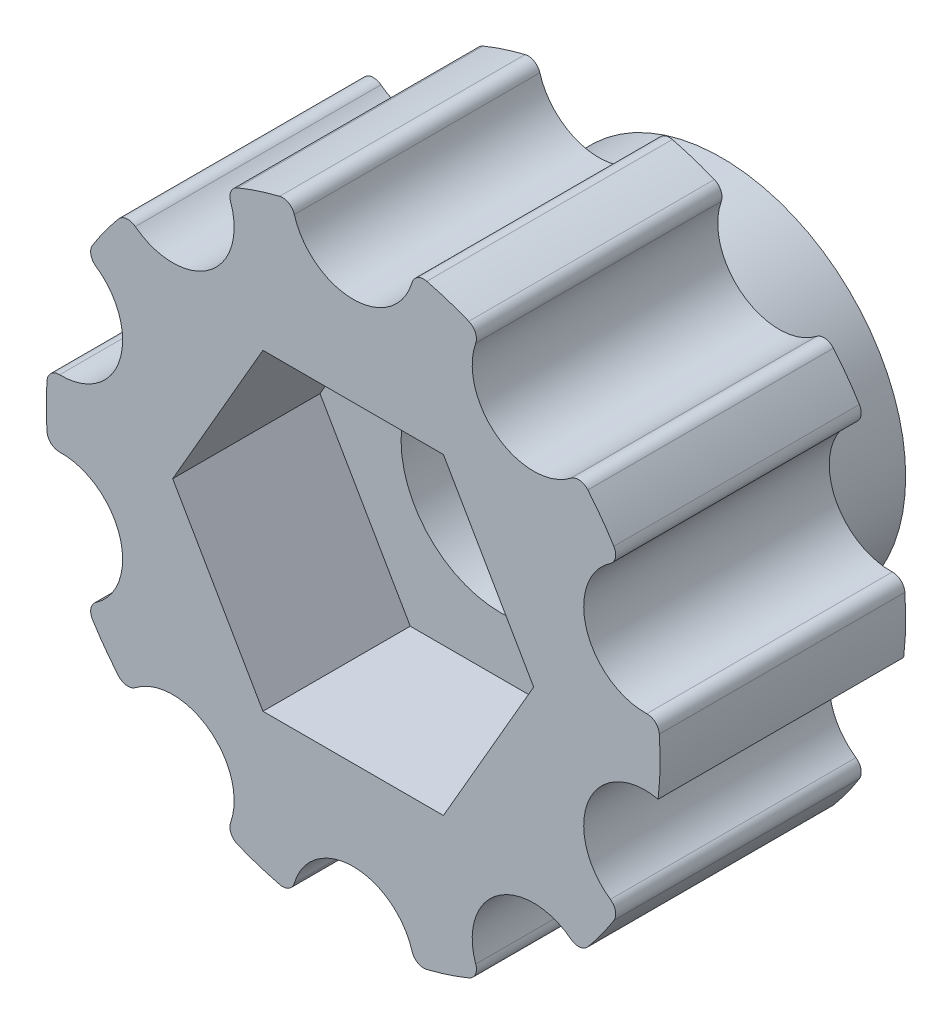
from build123d import *

# Parameters (mm, degrees)
SKETCH1_R           = 12.5
BOSS_EXTRUDE1_DEPTH = 10
SKETCH2_R           = 7.5
BOSS_EXTRUDE2_DEPTH = 5
SKETCH3_R           = 4.05
CUT_EXTRUDE1_DEPTH  = 24.184046239
CUT_EXTRUDE2_DEPTH  = 6
SKETCH5_R           = 2.5
CUT_EXTRUDE3_DEPTH  = 24.184046239
FILLET1_R           = 0.5


with BuildPart() as part:
    # Sketch1 → Boss-Extrude1 (new body)
    with BuildSketch(Plane.XY):
        Circle(SKETCH1_R)
    extrude(amount=BOSS_EXTRUDE1_DEPTH)

    # Sketch2 → Boss-Extrude2 (add)
    with BuildSketch(Plane(origin=(0, 0, 0), x_dir=(-1, 0, 0), z_dir=(0, 0, -1))):
        Circle(SKETCH2_R)
    extrude(amount=BOSS_EXTRUDE2_DEPTH)

    # Sketch3 → Cut-Extrude1 (cut, through all)
    with BuildSketch(Plane(origin=(0, 0, -5), x_dir=(-1, 0, 0), z_dir=(0, 0, -1))):
        Circle(SKETCH3_R)
    extrude(amount=-CUT_EXTRUDE1_DEPTH, mode=Mode.SUBTRACT)

    # Sketch4 → Cut-Extrude2 (cut)
    with BuildSketch(Plane.XY.offset(10)):
        Polygon((3.675, 6.365286718), (-3.675, 6.365286718), (-7.35, 0), (-3.675, -6.365286718), (3.675, -6.365286718), (7.35, 0), align=None)
    extrude(amount=-CUT_EXTRUDE2_DEPTH, mode=Mode.SUBTRACT)

    # Sketch5 → Cut-Extrude3 (cut, through all)
    with BuildSketch(Plane.XY.offset(10)):
        with Locations((0, 12.5)):
            Circle(SKETCH5_R)
        with Locations((7.347315654, 10.11271243)):
            Circle(SKETCH5_R)
        with Locations((11.888206454, 3.86271243)):
            Circle(SKETCH5_R)
        with Locations((11.888206454, -3.86271243)):
            Circle(SKETCH5_R)
        with Locations((7.347315654, -10.11271243)):
            Circle(SKETCH5_R)
        with Locations((0, -12.5)):
            Circle(SKETCH5_R)
        with Locations((-7.347315654, -10.11271243)):
            Circle(SKETCH5_R)
        with Locations((-11.888206454, -3.86271243)):
            Circle(SKETCH5_R)
        with Locations((-11.888206454, 3.86271243)):
            Circle(SKETCH5_R)
        with Locations((-7.347315654, 10.11271243)):
            Circle(SKETCH5_R)
    extrude(amount=-CUT_EXTRUDE3_DEPTH, mode=Mode.SUBTRACT)

    # Fillet1
    fillet1_edges = [part.edges().sort_by_distance(p)[0] for p in [
        (9.212773705, 8.448360827, 5),
        (5.187964976, 11.372555535, 5),
        (12.419112393, 1.419734967, 5),
        (10.881772256, 6.151181395, 5),
        (10.881772256, -6.151181395, 5),
        (5.187964976, -11.372555535, 5),
        (9.212773705, -8.448360827, 5),
        (-2.487468593, -12.25, 5),
        (2.487468593, -12.25, 5),
        (-9.212773705, -8.448360827, 5),
        (-5.187964976, -11.372555535, 5),
        (-12.419112393, -1.419734967, 5),
        (-10.881772256, -6.151181395, 5),
        (-10.881772256, 6.151181395, 5),
        (-12.419112393, 1.419734967, 5),
        (-5.187964976, 11.372555535, 5),
        (-9.212773705, 8.448360827, 5),
        (2.487468593, 12.25, 5),
        (-2.487468593, 12.25, 5),
    ]]
    fillet(fillet1_edges, radius=FILLET1_R)


solid = part.part
